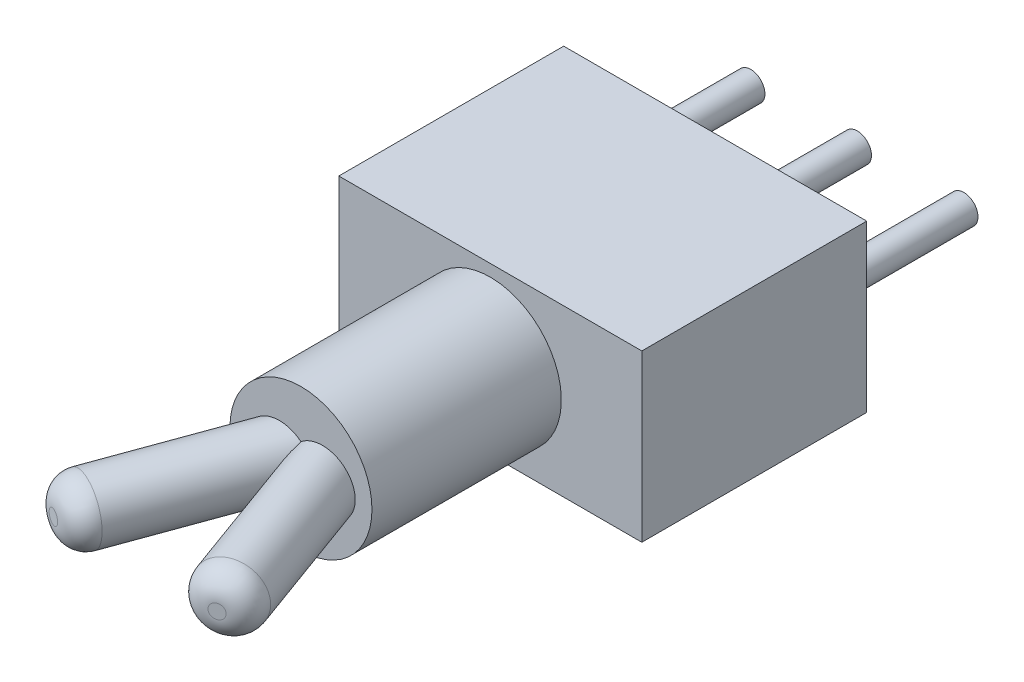
from build123d import *

# Parameters (mm, degrees)
SKETCH1_W            = 12.8
SKETCH1_H            = 9.5
BOSS_EXTRUDE1_DEPTH  = 3.5
SKETCH2_R            = 3
BOSS_EXTRUDE2_DEPTH  = 8
SKETCH4_R            = 1.3
BOSS_EXTRUDE3_DEPTH  = 10
FILLET1_R            = 1
FILLET1_OF_MIRROR1_R = 1
SKETCH5_R            = 0.6
BOSS_EXTRUDE4_DEPTH  = 6


with BuildPart() as part:
    # Sketch1 → Boss-Extrude1 (new, symmetric)
    with BuildSketch(Plane(origin=(0, 0, 0), x_dir=(1, 0, 0), z_dir=(0, 1, 0))):
        Rectangle(SKETCH1_W, SKETCH1_H)
    extrude(amount=BOSS_EXTRUDE1_DEPTH, both=True)

    # Sketch2 → Boss-Extrude2 (add)
    with BuildSketch(Plane.XY.offset(4.75)):
        with Locations(Location((0, 0, 0), (0, 0, 180))):
            Circle(SKETCH2_R)
    extrude(amount=BOSS_EXTRUDE2_DEPTH)

    # Sketch4 → Boss-Extrude3 (add)
    with BuildSketch(Plane(origin=(3.457717226, 0, 19.75), x_dir=(0.9396926207859079, 0, -0.34202014332567043), z_dir=(0.34202014332567043, 0, 0.9396926207859079))):
        Circle(SKETCH4_R)
    boss_extrude3 = extrude(amount=-BOSS_EXTRUDE3_DEPTH)

    # Fillet1
    fillet1_edges = [part.edges().sort_by_distance(p)[0] for p in [
        (2.236116819, 0, 20.194626186),
    ]]
    fillet(fillet1_edges, radius=FILLET1_R)

    # Mirror1: Boss-Extrude3 across plane
    add(boss_extrude3.mirror(Plane(origin=(0, 0, 0), x_dir=(0, 0, 1), z_dir=(1, 0, 0))))

    # Fillet1 of Mirror1
    fillet1_of_mirror1_edges = [part.edges().sort_by_distance(p)[0] for p in [
        (-2.236116819, 0, 20.194626186),
    ]]
    fillet(fillet1_of_mirror1_edges, radius=FILLET1_OF_MIRROR1_R)

    # Sketch5 → Boss-Extrude4 (add)
    with BuildSketch(Plane(origin=(0, 0, -4.75), x_dir=(-1, 0, 0), z_dir=(0, 0, -1))):
        with Locations(Location((0, 0, 0), (0, 0, 180))):
            Circle(SKETCH5_R)
        with Locations(Location((-4.5, 0, 0), (0, 0, 180))):
            Circle(SKETCH5_R)
        with Locations(Location((4.5, 0, 0), (0, 0, 180))):
            Circle(SKETCH5_R)
    extrude(amount=BOSS_EXTRUDE4_DEPTH)


solid = part.part
